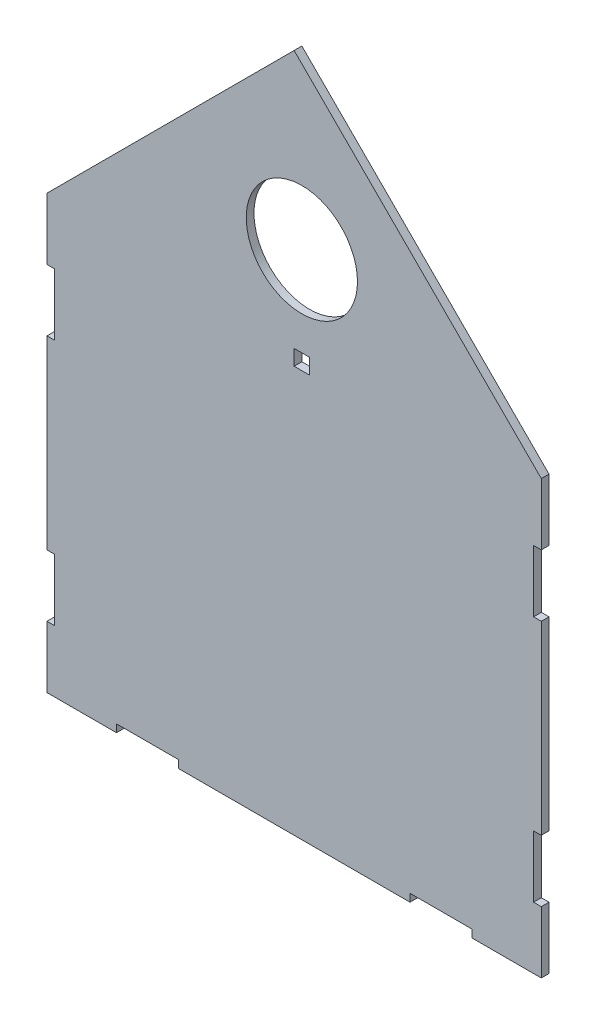
from build123d import *

# Parameters (mm, degrees)
BOSS_EXTRUDE1_DEPTH = 3.175
SKETCH3_R           = 22.86
CUT_EXTRUDE1_DEPTH  = 3.175
SKETCH5_W           = 6.35
SKETCH5_H           = 6.35
CUT_EXTRUDE2_DEPTH  = 3.175


with BuildPart() as part:
    # Sketch2 → Boss-Extrude1 (new body)
    with BuildSketch(Plane.XY):
        Polygon((0.564315933, 279.4), (-101.035684067, 177.8), (-101.035684067, 152.4), (-97.860684067, 152.4), (-97.860684067, 127), (-101.035684067, 127), (-101.035684067, 50.8), (-97.860684067, 50.8), (-97.860684067, 25.4), (-101.035684067, 25.4), (-101.035684067, 0), (-72.460684067, 0), (-72.460684067, 3.175), (-47.060684067, 3.175), (-47.060684067, 0), (48.189315933, 0), (48.189315933, 3.175), (73.589315933, 3.175), (73.589315933, 0), (102.164315933, 0), (102.164315933, 25.4), (98.989315933, 25.4), (98.989315933, 50.8), (102.164315933, 50.8), (102.164315933, 127), (98.989315933, 127), (98.989315933, 152.4), (102.164315933, 152.4), (102.164315933, 177.8), align=None)
    extrude(amount=BOSS_EXTRUDE1_DEPTH)

    # Sketch3 → Cut-Extrude1 (cut)
    with BuildSketch(Plane.XY.offset(3.175)):
        with Locations((3.739315933, 210.078311119)):
            Circle(SKETCH3_R)
    extrude(amount=-CUT_EXTRUDE1_DEPTH, mode=Mode.SUBTRACT)

    # Sketch5 → Cut-Extrude2 (cut)
    with BuildSketch(Plane.XY.offset(3.175)):
        with Locations((3.739315933, 170.159778504)):
            Rectangle(SKETCH5_W, SKETCH5_H)
    extrude(amount=-CUT_EXTRUDE2_DEPTH, mode=Mode.SUBTRACT)


solid = part.part
